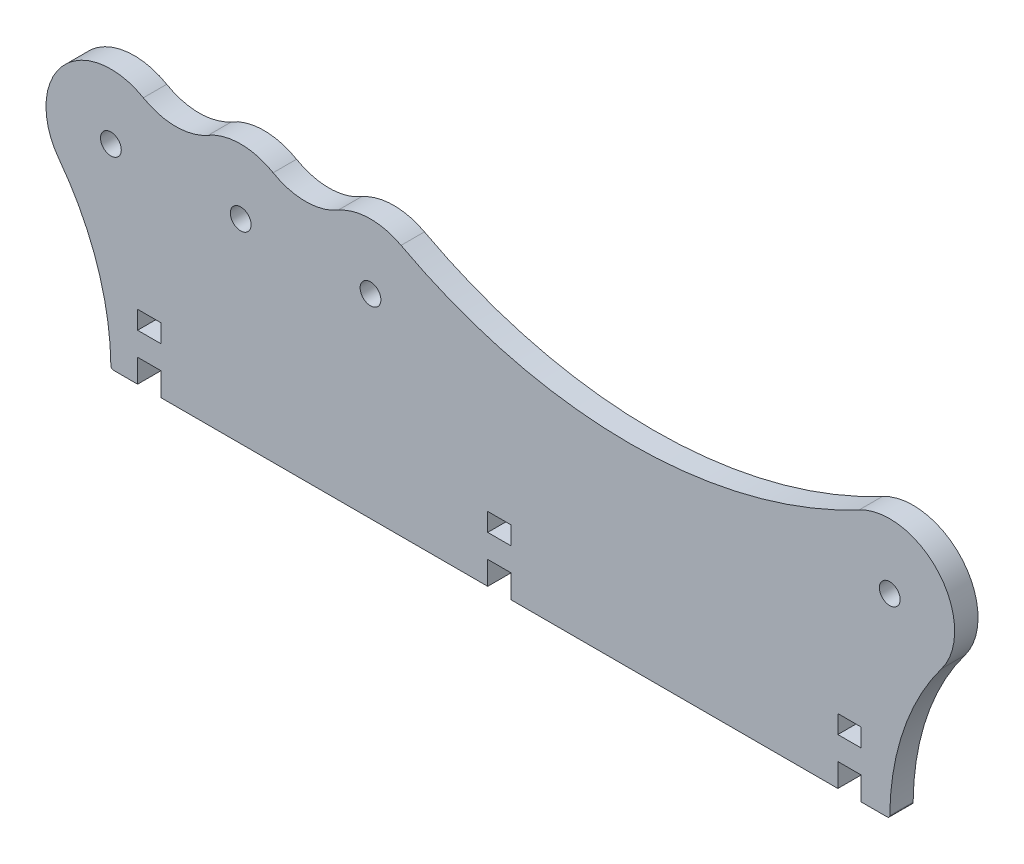
from build123d import *

# Parameters (mm, degrees)
SKETCH1_R             = 8
SKETCH1_R_2           = 4
BOSS_EXTRUDE1_DEPTH   = 9
BOSS_EXTRUDE1_2_DEPTH = 9
SKETCH2_R             = 4
BOSS_EXTRUDE3_DEPTH   = 9
FILLET1_R             = 1
SKETCH3_W             = 9
SKETCH3_H             = 9
SKETCH3_H_2           = 7
CUT_EXTRUDE1_DEPTH    = 214.789616212


with BuildPart() as part:
    # Sketch1 → Boss-Extrude1 (new body)
    with BuildSketch(Plane.XY):
        with Locations((-125, 0)):
            Circle(SKETCH1_R)
        with Locations((-125, 0)):
            Circle(SKETCH1_R_2, mode=Mode.SUBTRACT)
    extrude(amount=BOSS_EXTRUDE1_DEPTH)



with BuildPart() as body_2:
    # Sketch1 → Boss-Extrude1 2 (new body)
    with BuildSketch(Plane.XY):
        with Locations((125, 0)):
            Circle(SKETCH1_R)
        with Locations((125, 0)):
            Circle(SKETCH1_R_2, mode=Mode.SUBTRACT)
    extrude(amount=BOSS_EXTRUDE1_2_DEPTH)


with BuildPart() as part_1:
    add(part.part)

    add(body_2.part)  # Boss-Extrude3 merges body 2
    # Sketch2 → Boss-Extrude3 (add)
    with BuildSketch(Plane.XY):
        with BuildLine():
            Line((-175, -75), (125, -75))
            ThreePointArc((125, -75), (130.131670325, -43.377223009), (145.000000492, -14.999999344))
            ThreePointArc((145.000000492, -14.999999344), (143.981414944, 16.269784471), (113.235294528, 22.058823748))
            ThreePointArc((113.235294528, 22.058823748), (25.000000075, 0), (-63.235294395, 22.058823677))
            ThreePointArc((-63.235294395, 22.058823677), (-75.420498385, 24.996463372), (-87.499999896, 21.650635154))
            ThreePointArc((-87.499999896, 21.650635154), (-99.999999954, 18.301270189), (-112.500000024, 21.650635108))
            ThreePointArc((-112.500000024, 21.650635108), (-124.99999995, 25), (-137.49999989, 21.650635158))
            ThreePointArc((-137.49999989, 21.650635158), (-149.999999954, 18.301270189), (-162.50000003, 21.650635112))
            ThreePointArc((-162.50000003, 21.650635112), (-193.705072901, 16.586749162), (-195.000000551, -14.999999265))
            ThreePointArc((-195.000000551, -14.999999265), (-180.13167034, -43.377222962), (-175, -75))
        make_face()
        with Locations((125, 0)):
            Circle(SKETCH2_R, mode=Mode.SUBTRACT)
        with Locations((-175, 0)):
            Circle(SKETCH2_R, mode=Mode.SUBTRACT)
        with Locations((-125, 0)):
            Circle(SKETCH2_R, mode=Mode.SUBTRACT)
        with Locations((-75, 0)):
            Circle(SKETCH2_R, mode=Mode.SUBTRACT)
    extrude(amount=BOSS_EXTRUDE3_DEPTH)

    # Fillet1
    fillet1_edges = [part_1.edges().sort_by_distance(p)[0] for p in [
        (-175, -75, 4.5),
        (125, -75, 4.5),
    ]]
    fillet(fillet1_edges, radius=FILLET1_R)

    # Sketch3 → Cut-Extrude1 (cut, through all)
    with BuildSketch(Plane.XY):
        with Locations((-160.208548161, -70.5)):
            Rectangle(SKETCH3_W, SKETCH3_H)
        with Locations((-25.351798772, -70.5)):
            Rectangle(SKETCH3_W, SKETCH3_H)
        with Locations((109.504950616, -70.5)):
            Rectangle(SKETCH3_W, SKETCH3_H)
        with Locations((-160.208548161, -53.5)):
            Rectangle(SKETCH3_W, SKETCH3_H_2)
        with Locations((-25.351798772, -53.5)):
            Rectangle(SKETCH3_W, SKETCH3_H_2)
        with Locations((109.504950616, -53.5)):
            Rectangle(SKETCH3_W, SKETCH3_H_2)
    extrude(amount=CUT_EXTRUDE1_DEPTH, mode=Mode.SUBTRACT)


solid = part_1.part
